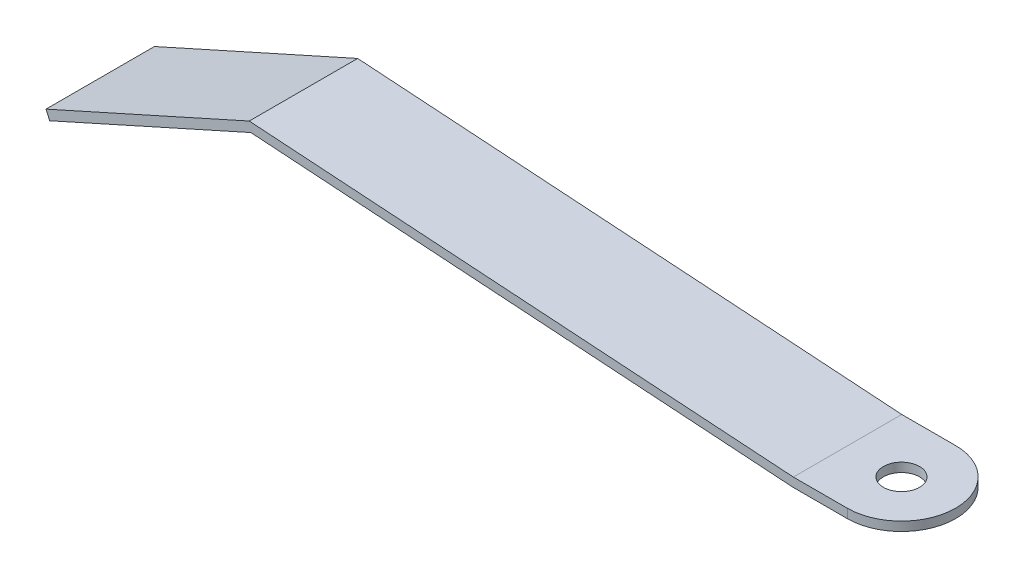
from build123d import *

# Parameters (mm, degrees)
EXTRUDE_THIN1_DEPTH   = 6
FILLET1_RADIUS        = 3
FILLET1_LENGTH        = 0.5
F_2_0MM_DOWEL_HOLE1_D = 2


with BuildPart() as part:
    # Sketch1 → Extrude-Thin1 (new body)
    with BuildSketch(Plane.XY):
        Polygon((0, 0), (-6, 0), (-36, 2), (-47.132818026, -3), (-47.337667505, -2.543889606), (-36.091128385, 2.507185105), (-5.983351811, 0.5), (0, 0.5), align=None)
    extrude(amount=EXTRUDE_THIN1_DEPTH)

    # Fillet1: full round fillet: the end face becomes a half cylinder, R = half its width
    fillet1_face = Plane((0, 0.25, 3), x_dir=(0, -1, 0), z_dir=(1, 0, 0))  # on the end face: x along it, z out of the body
    fillet1_slab = fillet1_face.offset(-FILLET1_RADIUS / 2) * Box(FILLET1_LENGTH, 2 * FILLET1_RADIUS, FILLET1_RADIUS, mode=Mode.PRIVATE)  # the body's end, R deep
    fillet1_round = Plane((-3, 0.25, 3), x_dir=(1, 0, 0), z_dir=(0, -1, 0)) * Cylinder(FILLET1_RADIUS, FILLET1_LENGTH, mode=Mode.PRIVATE)  # its axis R under the face
    add(fillet1_slab - fillet1_round, mode=Mode.SUBTRACT)

    # Ø2.0mm Dowel Hole1 (through all)
    with Locations(Plane(origin=(0, 0.5, 0), x_dir=(1, 0, 0), z_dir=(0, 1, 0))):
        with Locations((-3, -3)):
            Hole(F_2_0MM_DOWEL_HOLE1_D / 2)


solid = part.part
